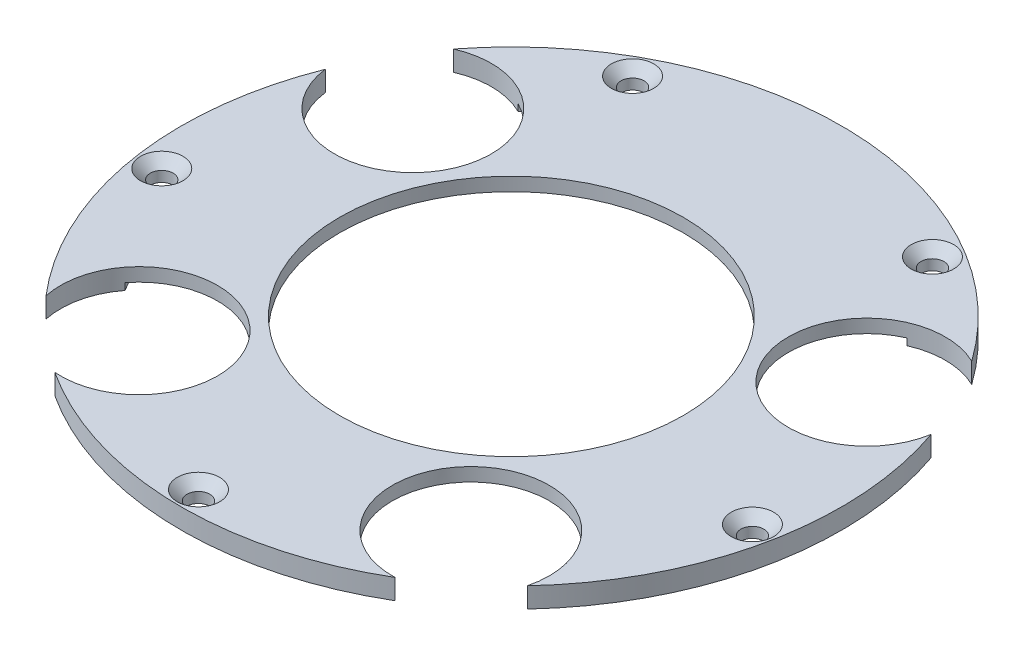
from build123d import *
from build123d.topology import SkipClean

# Parameters (mm, degrees)
SKETCH1_R                                      = 25.506
BOSS_EXTRUDE1_DEPTH                            = 2
BOSS_EXTRUDE2_START                            = -3
BOSS_EXTRUDE2_DEPTH                            = 3
BOSS_EXTRUDE6_START                            = -3
BOSS_EXTRUDE6_DEPTH                            = 3
SKETCH25_R                                     = 1.7
CUT_EXTRUDE16_DEPTH                            = 95.198280418
CSK_FOR_M3_FLAT_HEAD_MACHINE_SCREW1_AT_2_COUNT = 2
CSK_FOR_M3_FLAT_HEAD_MACHINE_SCREW1_AT_2_PITCH = 45.5
CSK_FOR_M3_FLAT_HEAD_MACHINE_SCREW1_AT_3_COUNT = 2
CSK_FOR_M3_FLAT_HEAD_MACHINE_SCREW1_AT_3_PITCH = 82.47400862
CSK_FOR_M3_FLAT_HEAD_MACHINE_SCREW1_AT_4_COUNT = 2
CSK_FOR_M3_FLAT_HEAD_MACHINE_SCREW1_AT_4_PITCH = 87.899250192
CSK_FOR_M3_FLAT_HEAD_MACHINE_SCREW1_AT_5_COUNT = 2
CSK_FOR_M3_FLAT_HEAD_MACHINE_SCREW1_AT_5_PITCH = 52.195455708
CUT_EXTRUDE18_START                            = -10
SKETCH38_R                                     = 11.65
SKETCH38_R_2                                   = 10.65
CUT_EXTRUDE18_DEPTH                            = 10


with BuildPart() as part:
    # Sketch1 → Boss-Extrude1 (new body)
    with BuildSketch(Plane(origin=(0, 0, 0), x_dir=(-1, 0, 0), z_dir=(0, 1, 0))):
        with BuildLine():
            ThreePointArc((-61.273022956, -25.549853724), (-30.300207038, -39.91692623), (1.257982902, -26.885857738))
            ThreePointArc((1.257982902, -26.885857738), (-4.612463385, -11.513091013), (11.606251263, -8.731474296))
            ThreePointArc((11.606251263, -8.731474296), (12.556026093, 9.673988398), (5.631693186, 26.753705697))
            ThreePointArc((5.631693186, 26.753705697), (-10.603691781, 24.071100363), (-10.090754324, 40.518622716))
            ThreePointArc((-10.090754324, 40.518622716), (-28.482933471, 45.139662538), (-47.055700073, 41.308395969))
            ThreePointArc((-47.055700073, 41.308395969), (-47.245727944, 24.853974503), (-63.351719399, 28.227568381))
            ThreePointArc((-63.351719399, 28.227568381), (-70.999232707, 11.459185352), (-70.836448279, -6.970047687))
            ThreePointArc((-70.836448279, -6.970047687), (-54.751340848, -10.441850583), (-61.273022956, -25.549853724))
        make_face()
        with Locations(Location((-29.391570254, 2.611368154, 0), (0, 0, 90))):
            Circle(SKETCH1_R, mode=Mode.SUBTRACT)
    extrude(amount=BOSS_EXTRUDE1_DEPTH)

    # Sketch2 → Boss-Extrude2 (add)
    with SkipClean():  # the faces are left unmerged after this step: merging them gives an invalid solid
        with BuildSketch(Plane(origin=(0, 2, 0), x_dir=(1, 0, 0), z_dir=(0, 1, 0)).offset(BOSS_EXTRUDE2_START)):
            with BuildLine():
                ThreePointArc((8.100781322, -41.730874166), (9.584878111, -40.885466148), (10.914743148, -39.813683997))
                ThreePointArc((10.914743148, -39.813683997), (28.504294061, -44.139890701), (46.262572123, -40.568906798))
                ThreePointArc((46.262572123, -40.568906798), (47.545446241, -41.696511336), (48.99208013, -42.604535778))
                ThreePointArc((48.99208013, -42.604535778), (28.44021229, -47.139206211), (8.100781322, -41.730874166))
            make_face()
            with BuildLine():
                ThreePointArc((64.198332324, -30.398465127), (63.624713683, -28.789670656), (62.801291616, -27.293263594))
                ThreePointArc((62.801291616, -27.293263594), (70.021103448, -11.251187393), (69.953480433, 6.340552681))
                ThreePointArc((69.953480433, 6.340552681), (71.314539545, 7.372432563), (72.493139985, 8.608619846))
                ThreePointArc((72.493139985, 8.608619846), (72.955491227, -11.875181271), (64.198332324, -30.398465127))
            make_face()
            with BuildLine():
                ThreePointArc((63.569251617, 25.945934601), (61.87831648, 25.705110274), (60.247624932, 25.197071819))
                ThreePointArc((60.247624932, 25.197071819), (30.278846447, 38.917154393), (-0.248588426, 26.489601545))
                ThreePointArc((-0.248588426, 26.489601545), (-1.856092836, 27.066825563), (-3.535198959, 27.379652388))
                ThreePointArc((-3.535198959, 27.379652388), (30.342928218, 41.916469903), (63.569251617, 25.945934601))
            make_face()
            with BuildLine():
                ThreePointArc((-5.0418622, -25.843763068), (-5.928446542, -27.303635049), (-6.570255645, -28.886461341))
                ThreePointArc((-6.570255645, -28.886461341), (-14.528267211, -10.006050096), (-13.191445392, 10.439310852))
                ThreePointArc((-13.191445392, 10.439310852), (-12.066719813, 9.153911938), (-10.750975803, 8.064840913))
                ThreePointArc((-10.750975803, 8.064840913), (-11.569905534, -9.50795755), (-5.0418622, -25.843763068))
            make_face()
        extrude(amount=BOSS_EXTRUDE2_DEPTH)

    # Sketch24 → Boss-Extrude6 (add)
    with SkipClean():  # the faces are left unmerged after this step: merging them gives an invalid solid
        with BuildSketch(Plane(origin=(0, 2, 0), x_dir=(1, 0, 0), z_dir=(0, 1, 0)).offset(BOSS_EXTRUDE6_START)):
            with BuildLine():
                ThreePointArc((70.669999692, 23.791117773), (30.438076993, 46.377455303), (-10.721688888, 25.529819472))
                ThreePointArc((-10.721688888, 25.529819472), (-7.294770946, 27.100906435), (-3.535198959, 27.379652388))
                ThreePointArc((-3.535198959, 27.379652388), (30.342885438, 41.916470817), (63.569196745, 25.946000272))
                ThreePointArc((63.569196745, 25.946000272), (67.313347493, 25.5070047), (70.669999692, 23.791117773))
            make_face()
            with BuildLine():
                ThreePointArc((-13.191445392, 10.439310852), (-14.8672068, 13.816277617), (-15.261471823, 17.565495658))
                ThreePointArc((-15.261471823, 17.565495658), (-18.928337146, -10.746879743), (-6.19266673, -36.297597956))
                ThreePointArc((-6.19266673, -36.297597956), (-7.047830714, -32.625980412), (-6.570255645, -28.886461341))
                ThreePointArc((-6.570255645, -28.886461341), (-14.528267211, -10.006050096), (-13.191445392, 10.439310852))
            make_face()
            with BuildLine():
                ThreePointArc((78.391570254, -2.611368154), (77.502051415, 6.682802197), (74.86579056, 15.639530113))
                ThreePointArc((74.86579056, 15.639530113), (74.31165682, 11.910680729), (72.493175524, 8.608483323))
                ThreePointArc((72.493175524, 8.608483323), (72.955476555, -11.875250265), (64.198332324, -30.398465127))
                ThreePointArc((64.198332324, -30.398465127), (64.515751364, -34.154969617), (63.504547713, -37.786711349))
                ThreePointArc((63.504547713, -37.786711349), (74.516595991, -21.709327528), (78.391570254, -2.611368154))
            make_face()
            with BuildLine():
                ThreePointArc((8.100781322, -41.730874166), (4.457207722, -42.698578795), (0.704767353, -42.336263866))
                ThreePointArc((0.704767353, -42.336263866), (28.344901337, -51.600188146), (56.355487807, -43.525267384))
                ThreePointArc((56.355487807, -43.525267384), (52.590996737, -43.726979578), (48.99208013, -42.604535778))
                ThreePointArc((48.99208013, -42.604535778), (28.44021229, -47.139206211), (8.100781322, -41.730874166))
            make_face()
        extrude(amount=BOSS_EXTRUDE6_DEPTH)

    # Sketch25 → Cut-Extrude16 (cut, through all)
    with SkipClean():  # the faces are left unmerged after this step: merging them gives an invalid solid
        with BuildSketch(Plane(origin=(0.062486446, 2, -0.627225467), x_dir=(-0.9997718365651259, 0, -0.02136059014154422), z_dir=(0, 1, 0))):
            with Locations(Location((-29.391570254, 48.111368154, 0), (0, 0, 91.223964752))):
                Circle(SKETCH25_R)
            with Locations(Location((-74.200323016, 10.512360238, 0), (0, 0, 91.223964752))):
                Circle(SKETCH25_R)
            with Locations(Location((-52.141570254, -36.792787718, 0), (0, 0, 91.223964752))):
                Circle(SKETCH25_R)
            with Locations(Location((-6.641570254, -36.792787718, 0), (0, 0, 91.223964752))):
                Circle(SKETCH25_R)
            with Locations(Location((15.417182508, 10.512360238, 0), (0, 0, 91.223964752))):
                Circle(SKETCH25_R)
        extrude(amount=-CUT_EXTRUDE16_DEPTH, mode=Mode.SUBTRACT)

    # Sketch35 → CSK for M3 Flat Head Machine Screw1 (revolve, cut)
    with SkipClean():  # the faces are left unmerged after this step: merging them gives an invalid solid
        with BuildSketch(Plane(origin=(7.488456996, 2, -37.269750556), x_dir=(0, 0, 1), z_dir=(1, 0, 0))):
            Polygon((0, 0), (0, 3), (1.7, 3), (1.7, 1.45), (3.15, 0), align=None)
        csk_for_m3_flat_head_machine_screw1 = revolve(axis=Axis((7.488456996, 8.35, -37.269750556), (0, -1, 0)), mode=Mode.SUBTRACT)

    # CSK for M3 Flat Head Machine Screw1 at 2: CSK for M3 Flat Head Machine Screw1 ×2
    with SkipClean():  # the faces are left unmerged after this step: merging them gives an invalid solid
        with Locations(*[Vector(0.999771836565126, 0, 0.021360590141544296) * (i * CSK_FOR_M3_FLAT_HEAD_MACHINE_SCREW1_AT_2_PITCH) for i in range(1, CSK_FOR_M3_FLAT_HEAD_MACHINE_SCREW1_AT_2_COUNT)]):
            add(csk_for_m3_flat_head_machine_screw1, mode=Mode.SUBTRACT)

    # CSK for M3 Flat Head Machine Screw1 at 3: CSK for M3 Flat Head Machine Screw1 ×2
    with SkipClean():  # the faces are left unmerged after this step: merging them gives an invalid solid
        with Locations(*[Vector(0.8067132125731439, 0, 0.5909431382628263) * (i * CSK_FOR_M3_FLAT_HEAD_MACHINE_SCREW1_AT_3_PITCH) for i in range(1, CSK_FOR_M3_FLAT_HEAD_MACHINE_SCREW1_AT_3_COUNT)]):
            add(csk_for_m3_flat_head_machine_screw1, mode=Mode.SUBTRACT)

    # CSK for M3 Flat Head Machine Screw1 at 4: CSK for M3 Flat Head Machine Screw1 ×2
    with SkipClean():  # the faces are left unmerged after this step: merging them gives an invalid solid
        with Locations(*[Vector(0.23812724637768845, 0, 0.9712339648779689) * (i * CSK_FOR_M3_FLAT_HEAD_MACHINE_SCREW1_AT_4_PITCH) for i in range(1, CSK_FOR_M3_FLAT_HEAD_MACHINE_SCREW1_AT_4_COUNT)]):
            add(csk_for_m3_flat_head_machine_screw1, mode=Mode.SUBTRACT)

    # CSK for M3 Flat Head Machine Screw1 at 5: CSK for M3 Flat Head Machine Screw1 ×2
    with SkipClean():  # the faces are left unmerged after this step: merging them gives an invalid solid
        with Locations(*[Vector(-0.44188110488744076, 0, 0.8970736252635313) * (i * CSK_FOR_M3_FLAT_HEAD_MACHINE_SCREW1_AT_5_PITCH) for i in range(1, CSK_FOR_M3_FLAT_HEAD_MACHINE_SCREW1_AT_5_COUNT)]):
            add(csk_for_m3_flat_head_machine_screw1, mode=Mode.SUBTRACT)

    # Sketch38 → Cut-Extrude18 (cut)
    # profile 1 of 4: a face of its own
    with BuildSketch(Plane(origin=(0, 2, 0), x_dir=(1, 0, 0), z_dir=(0, 1, 0)).offset(CUT_EXTRUDE18_START)):
        with Locations((-4.639955385, 16.787107215)):
            Circle(SKETCH38_R)
        with Locations((-4.639955385, 16.787107215)):
            Circle(SKETCH38_R_2, mode=Mode.SUBTRACT)
    # profile 2 of 4: a face of its own
    with BuildSketch(Plane(origin=(0, 2, 0), x_dir=(1, 0, 0), z_dir=(0, 1, 0)).offset(CUT_EXTRUDE18_START)):
        with Locations((64.220577116, 15.315869921)):
            Circle(SKETCH38_R)
        with Locations((64.220577116, 15.315869921)):
            Circle(SKETCH38_R_2, mode=Mode.SUBTRACT)
    # profile 3 of 4: a face of its own
    with BuildSketch(Plane(origin=(0, 2, 0), x_dir=(1, 0, 0), z_dir=(0, 1, 0)).offset(CUT_EXTRUDE18_START)):
        with Locations((53.912398563, -33.159274187)):
            Circle(SKETCH38_R)
        with Locations((53.912398563, -33.159274187)):
            Circle(SKETCH38_R_2, mode=Mode.SUBTRACT)
    # profile 4 of 4: a face of its own
    with BuildSketch(Plane(origin=(0, 2, 0), x_dir=(1, 0, 0), z_dir=(0, 1, 0)).offset(CUT_EXTRUDE18_START)):
        with Locations((3.58837358, -32.084077995)):
            Circle(SKETCH38_R)
        with Locations((3.58837358, -32.084077995)):
            Circle(SKETCH38_R_2, mode=Mode.SUBTRACT)
    extrude(amount=CUT_EXTRUDE18_DEPTH, mode=Mode.SUBTRACT)


solid = part.part
